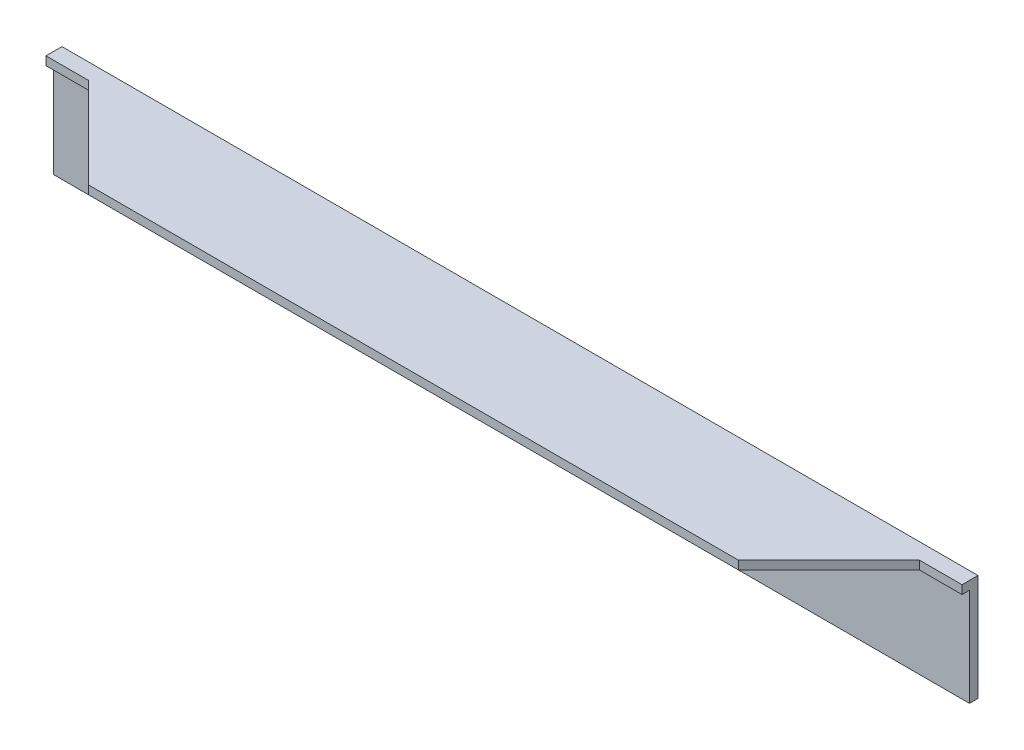
from build123d import *

# Parameters (mm, degrees)
SKETCH_1_W          = 860
SKETCH_1_H          = 100
EXTRUDE_1_DEPTH     = 8
SKETCH_2_W          = 860
SKETCH_2_H          = 8
EXTRUDE_2_DEPTH     = 92
CUT_EXTRUDE_1_DEPTH = 453.65881191


with BuildPart() as part:
    # 草图1 → 凸台-拉伸1 (new body)
    with BuildSketch(Plane.XY):
        with Locations((0, 50)):
            Rectangle(SKETCH_1_W, SKETCH_1_H)
    extrude(amount=EXTRUDE_1_DEPTH)

    # 草图2 → 凸台-拉伸2 (add)
    with BuildSketch(Plane.XY.offset(8)):
        with Locations((0, 96)):
            Rectangle(SKETCH_2_W, SKETCH_2_H)
    extrude(amount=EXTRUDE_2_DEPTH)

    # 草图4 → 切除-拉伸1 (cut, through all)
    with BuildSketch(Plane(origin=(0, 100, 0), x_dir=(1, 0, 0), z_dir=(0, 1, 0))):
        Polygon((-430, -15), (-390, -15), (-305, -100), (-430, -100), align=None)
    cut_extrude_1 = extrude(amount=-CUT_EXTRUDE_1_DEPTH, mode=Mode.SUBTRACT)

    # 镜向1: 切除-拉伸1 across plane
    add(cut_extrude_1.mirror(Plane(origin=(0, 0, 0), x_dir=(0, 0, 1), z_dir=(1, 0, 0))), mode=Mode.SUBTRACT)


solid = part.part
